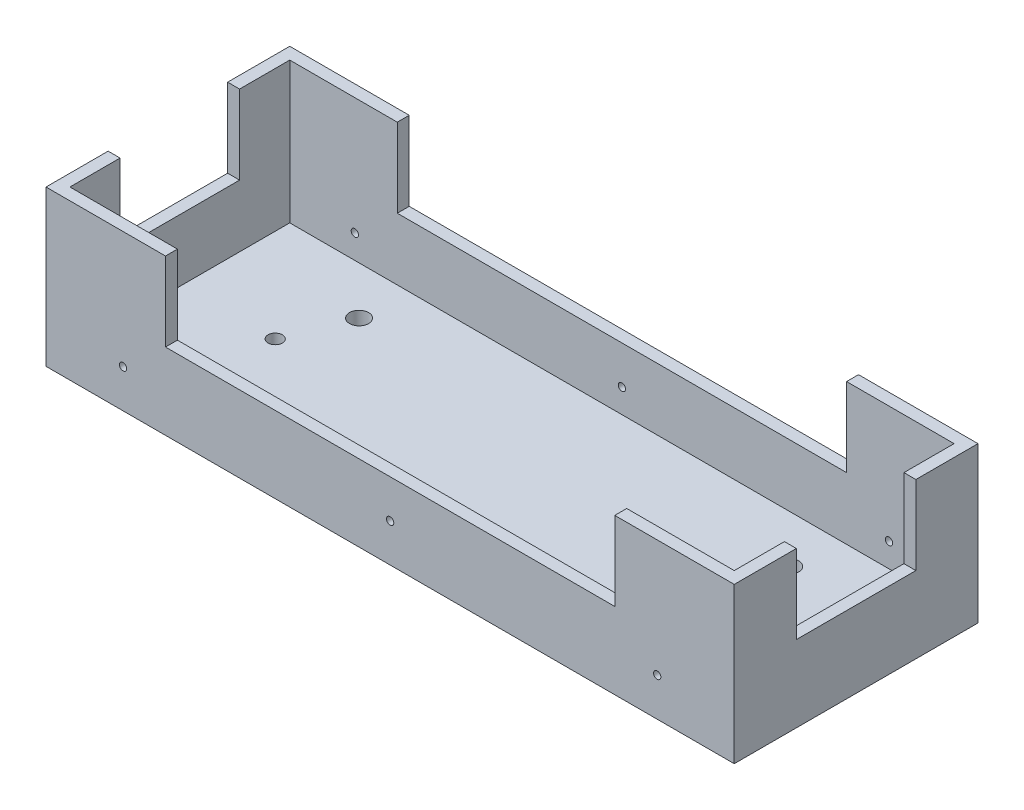
from build123d import *

# Parameters (mm, degrees)
SKETCH1_W           = 144
SKETCH1_H           = 51
BOSS_EXTRUDE1_DEPTH = 3
BOSS_EXTRUDE2_START = -3
SKETCH2_W           = 144
SKETCH2_H           = 51
SKETCH2_W_2         = 139
SKETCH2_H_2         = 46
BOSS_EXTRUDE2_DEPTH = 16
BOSS_EXTRUDE3_DEPTH = 16.5
SKETCH4_R           = 2
SKETCH4_R_2         = 1.5
CUT_EXTRUDE1_DEPTH  = 84.009035653
SKETCH5_R           = 0.762
CUT_EXTRUDE2_DEPTH  = 95.027921385


with BuildPart() as part:
    # Sketch1 → Boss-Extrude1 (new body)
    with BuildSketch(Plane(origin=(0, 0, 0), x_dir=(1, 0, 0), z_dir=(0, 1, 0))):
        Rectangle(SKETCH1_W, SKETCH1_H)
    extrude(amount=BOSS_EXTRUDE1_DEPTH)

    # Sketch2 → Boss-Extrude2 (add)
    with BuildSketch(Plane(origin=(0, 3, 0), x_dir=(1, 0, 0), z_dir=(0, 1, 0)).offset(BOSS_EXTRUDE2_START)):
        Rectangle(SKETCH2_W, SKETCH2_H)
        Rectangle(SKETCH2_W_2, SKETCH2_H_2, mode=Mode.SUBTRACT)
    extrude(amount=BOSS_EXTRUDE2_DEPTH)

    # Sketch3 → Boss-Extrude3 (add)
    with BuildSketch(Plane(origin=(0, 16, 0), x_dir=(1, 0, 0), z_dir=(0, 1, 0))):
        Polygon((-72, 25.5), (-72, 12.5), (-69.5, 12.5), (-69.5, 23), (-47, 23), (-47, 25.5), align=None)
        Polygon((47, 25.5), (72, 25.5), (72, 12.5), (69.5, 12.5), (69.5, 23), (47, 23), align=None)
        Polygon((72, -25.5), (72, -12.5), (69.5, -12.5), (69.5, -23), (47, -23), (47, -25.5), align=None)
        Polygon((-47, -25.5), (-72, -25.5), (-72, -12.5), (-69.5, -12.5), (-69.5, -23), (-47, -23), align=None)
    extrude(amount=BOSS_EXTRUDE3_DEPTH)

    # Sketch4 → Cut-Extrude1 (cut, through all)
    with BuildSketch(Plane.XZ):
        with Locations(Location((-45, -13, 0), (0, 0, 270))):
            Circle(SKETCH4_R)
        with Locations(Location((-45, 13, 0), (0, 0, 270))):
            Circle(SKETCH4_R)
        with Locations(Location((45, 13, 0), (0, 0, 270))):
            Circle(SKETCH4_R)
        with Locations(Location((45, -13, 0), (0, 0, 270))):
            Circle(SKETCH4_R)
        with Locations(Location((-50, -0.45, 0), (0, 0, 270))):
            Circle(SKETCH4_R_2)
        with Locations(Location((50, -0.45, 0), (0, 0, 270))):
            Circle(SKETCH4_R_2)
    extrude(amount=-CUT_EXTRUDE1_DEPTH, mode=Mode.SUBTRACT)

    # Sketch5 → Cut-Extrude2 (cut, through all)
    with BuildSketch(Plane.XY.offset(25.5)):
        with Locations((-55.88, 8)):
            Circle(SKETCH5_R)
        with Locations((55.88, 8)):
            Circle(SKETCH5_R)
        with Locations((0, 8)):
            Circle(SKETCH5_R)
    extrude(amount=-CUT_EXTRUDE2_DEPTH, mode=Mode.SUBTRACT)


solid = part.part
